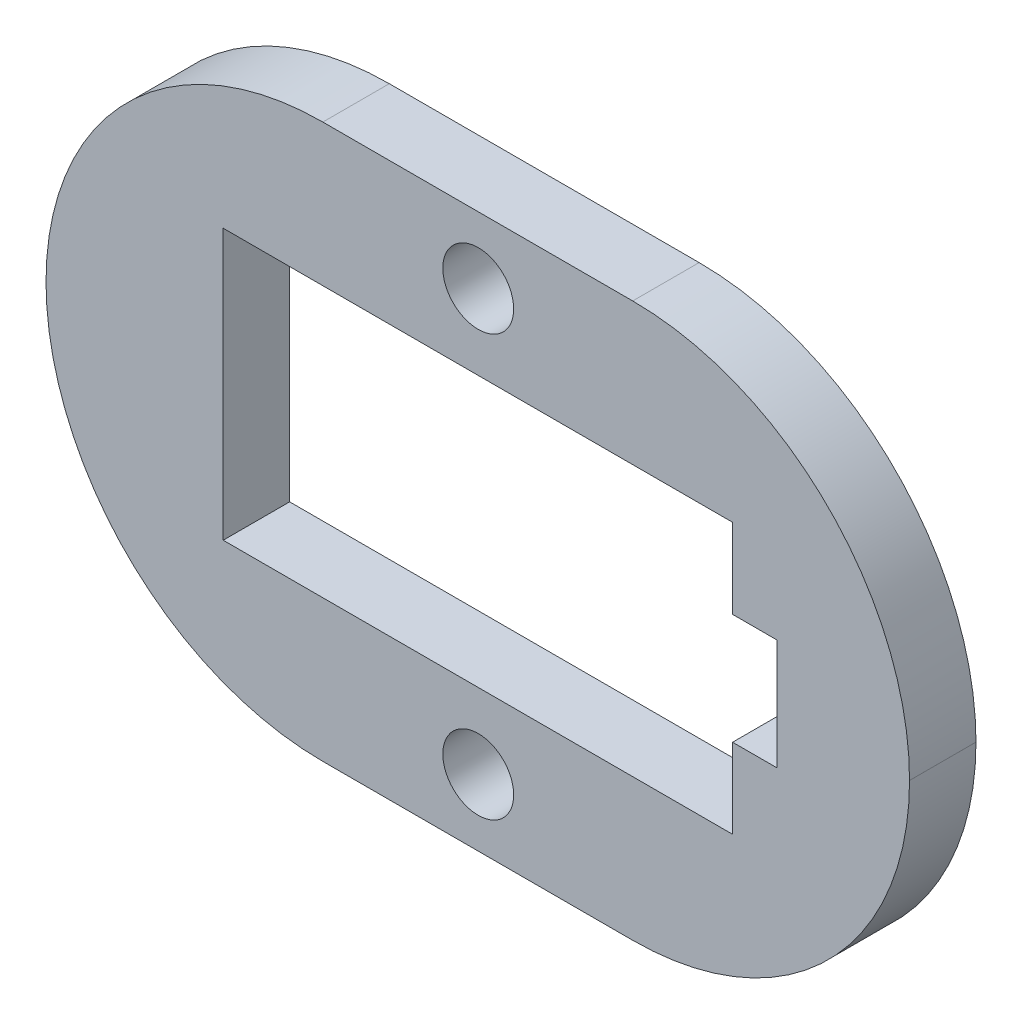
from build123d import *

# Parameters (mm, degrees)
SKETCH_1_R          = 1.3
EXTRUDE_1_DEPTH     = 3
SKETCH_2_R          = 1.6
CUT_EXTRUDE_1_DEPTH = 33.790082592


with BuildPart() as part:
    # 草图1 → 凸台-拉伸1 (new body)
    with BuildSketch(Plane(origin=(0, 0, 0), x_dir=(-1, 0, 0), z_dir=(0, 0, -1))):
        with BuildLine():
            Line((8.503321513, 25.001), (-5.486589193, 25.001))
            ThreePointArc((-5.486589193, 25.001), (-14.325423958, 21.339834765), (-17.986589193, 12.501))
            Line((-17.986589193, 12.501), (-17.986589193, 12.5))
            ThreePointArc((-17.986589193, 12.5), (-14.325423958, 3.661165235), (-5.486589193, 0))
            Line((-5.486589193, 0), (8.503321493, 0))
            ThreePointArc((8.503321493, 0), (17.342156257, 3.661165235), (21.003321493, 12.5))
            ThreePointArc((21.003321493, 12.5), (17.342509831, 21.339481206), (8.503321513, 25.001))
        make_face()
        with Locations(Location((1.487905971, 22.0005, 0), (0, 0, 180))):
            Circle(SKETCH_1_R, mode=Mode.SUBTRACT)
        with Locations(Location((1.487905971, 2.9995, 0), (0, 0, 180))):
            Circle(SKETCH_1_R, mode=Mode.SUBTRACT)
        Polygon((-11.997794717, 15), (-9.996894717, 15), (-9.996894717, 18.6), (13.002605283, 18.6), (13.002605283, 6.4), (-9.996894717, 6.4), (-9.996894717, 10.001), (-11.997794717, 10.001), align=None, mode=Mode.SUBTRACT)
    extrude(amount=-EXTRUDE_1_DEPTH)

    # 草图2 → 切除-拉伸1 (cut, through all)
    with BuildSketch(Plane.XY.offset(3)):
        with Locations((-1.487905971, 22.0005)):
            Circle(SKETCH_2_R)
        with Locations((-1.487905971, 2.9995)):
            Circle(SKETCH_2_R)
    extrude(amount=-CUT_EXTRUDE_1_DEPTH, mode=Mode.SUBTRACT)


solid = part.part
